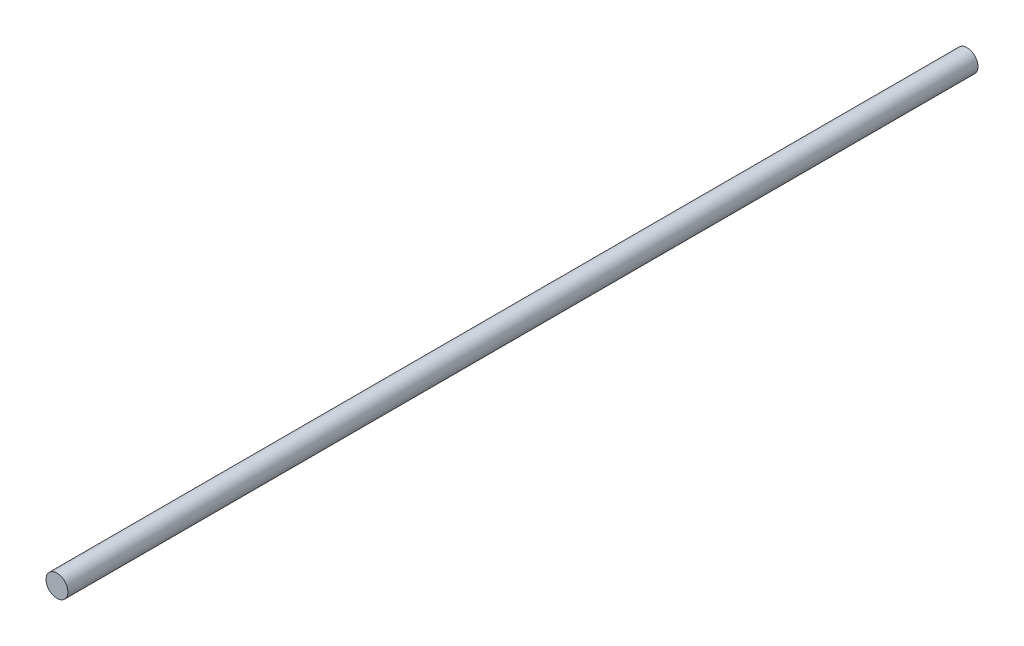
from build123d import *

# Parameters (mm, degrees)
SKETCH1_R           = 6.35
BOSS_EXTRUDE1_DEPTH = 527.05


with BuildPart() as part:
    # Sketch1 → Boss-Extrude1 (new body)
    with BuildSketch(Plane.XY):
        Circle(SKETCH1_R)
    extrude(amount=BOSS_EXTRUDE1_DEPTH)


solid = part.part
